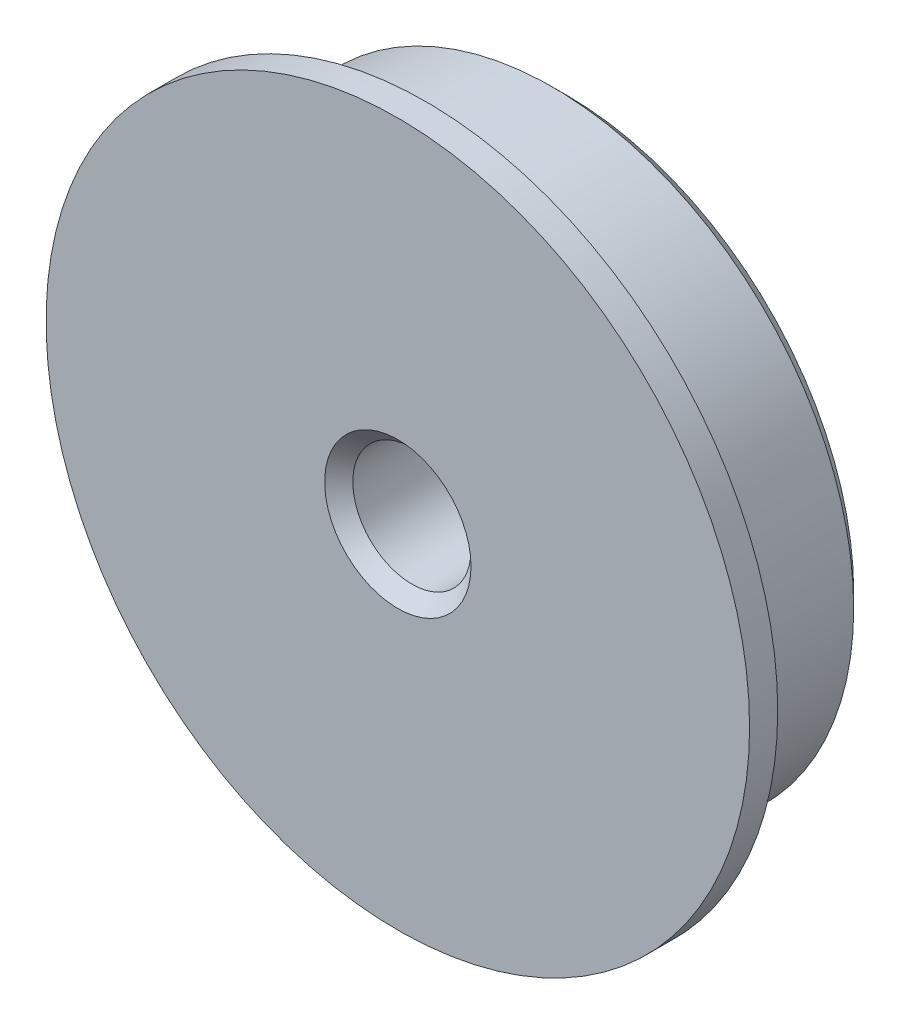
from build123d import *

# Parameters (mm, degrees)
ESQUISSE1_R                  = 21.4
BOSS_EXTRU_1_DEPTH           = 10
ESQUISSE2_R                  = 25
BOSS_EXTRU_2_DEPTH           = 2
ENL_V_MAT_EXTRU_1_DEPTH      = 38.336309405
ENL_V_MAT_EXTRU_1_DEPTH_BACK = 38.336309405
ESQUISSE3_R                  = 4.2
CHANFREIN1_SIZE              = 1


with BuildPart() as part:
    # Esquisse1 → Boss.-Extru.1 (new body)
    with BuildSketch(Plane.XY):
        Circle(ESQUISSE1_R)
    extrude(amount=BOSS_EXTRU_1_DEPTH)

    # Esquisse2 → Boss.-Extru.2 (add)
    with BuildSketch(Plane.XY.offset(10)):
        Circle(ESQUISSE2_R)
    extrude(amount=BOSS_EXTRU_2_DEPTH)

    # Esquisse3 → Enlèv. mat.-Extru.1 (cut, two sides: drawn at the far end of the back side and taken through both)
    with BuildSketch(Plane.XY.offset(12).offset(-ENL_V_MAT_EXTRU_1_DEPTH_BACK)):
        Circle(ESQUISSE3_R)
    extrude(amount=ENL_V_MAT_EXTRU_1_DEPTH + ENL_V_MAT_EXTRU_1_DEPTH_BACK, mode=Mode.SUBTRACT)

    # Chanfrein1
    chanfrein1_edges = [part.edges().sort_by_distance(p)[0] for p in [
        (-4.2, 0, 12),
        (-4.2, 0, 0),
        (-21.4, 0, 0),
    ]]
    chamfer(chanfrein1_edges, length=CHANFREIN1_SIZE)


solid = part.part
